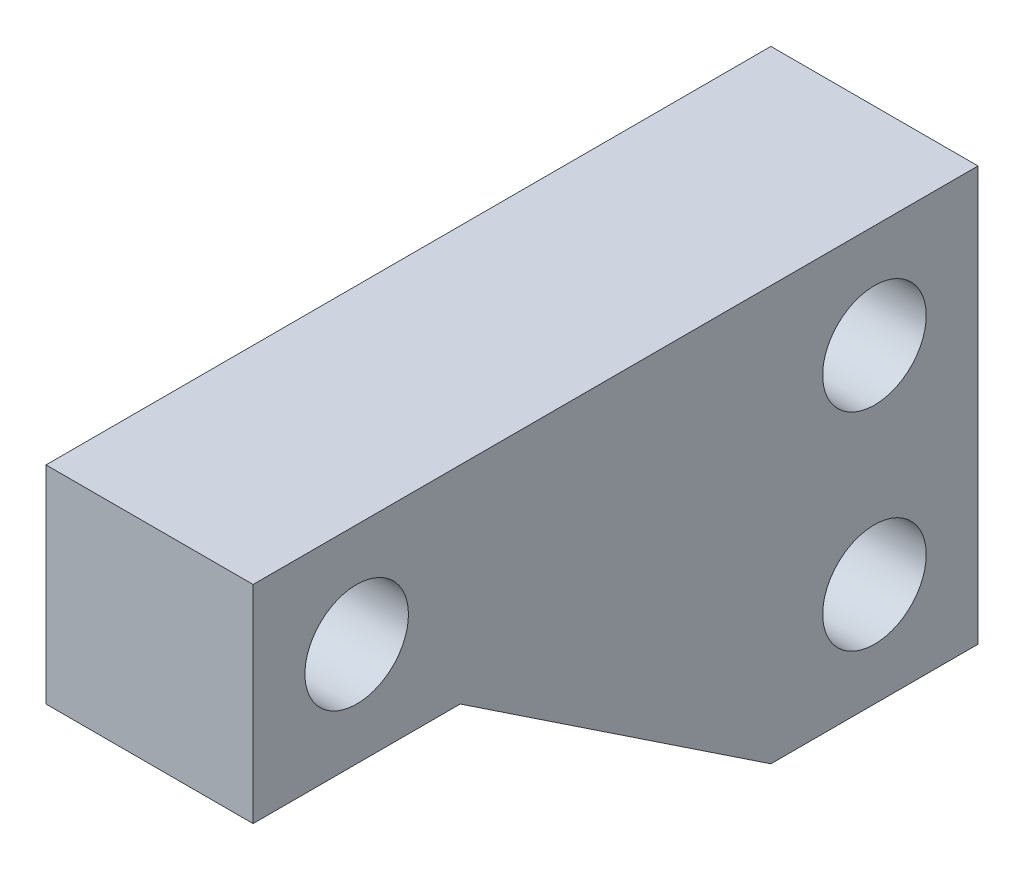
from build123d import *

# Parameters (mm, degrees)
ESQUISSE2_W        = 10
ESQUISSE2_H        = 10
ESQUISSE2_R        = 2.5
ESQUISSE2_H_2      = 20
BOSS_EXTRU_3_DEPTH = 10


with BuildPart() as part:
    # Esquisse2 → Boss.-Extru.3 (new body)
    # profile 1 of 3: a face of its own
    with BuildSketch(Plane(origin=(0, 0, 0), x_dir=(0, 0, -1), z_dir=(1, 0, 0))):
        Polygon((-22.246371136, 3.5143436), (-37.246371136, 3.5143436), (-37.246371136, -6.4856564), (-22.246371136, -16.4856564), align=None)
    # profile 2 of 3: a face of its own
    with BuildSketch(Plane(origin=(0, 0, 0), x_dir=(0, 0, -1), z_dir=(1, 0, 0))):
        with Locations((-42.246371136, -1.4856564)):
            Rectangle(ESQUISSE2_W, ESQUISSE2_H)
        with Locations((-42.246371136, -1.4856564)):
            Circle(ESQUISSE2_R, mode=Mode.SUBTRACT)
    # profile 3 of 3: a face of its own
    with BuildSketch(Plane(origin=(0, 0, 0), x_dir=(0, 0, -1), z_dir=(1, 0, 0))):
        with Locations((-17.246371136, -6.4856564)):
            Rectangle(ESQUISSE2_W, ESQUISSE2_H_2)
        with Locations((-17.246371136, -11.4856564)):
            Circle(ESQUISSE2_R, mode=Mode.SUBTRACT)
        with Locations((-17.246371136, -1.4856564)):
            Circle(ESQUISSE2_R, mode=Mode.SUBTRACT)
    extrude(amount=BOSS_EXTRU_3_DEPTH)


solid = part.part
